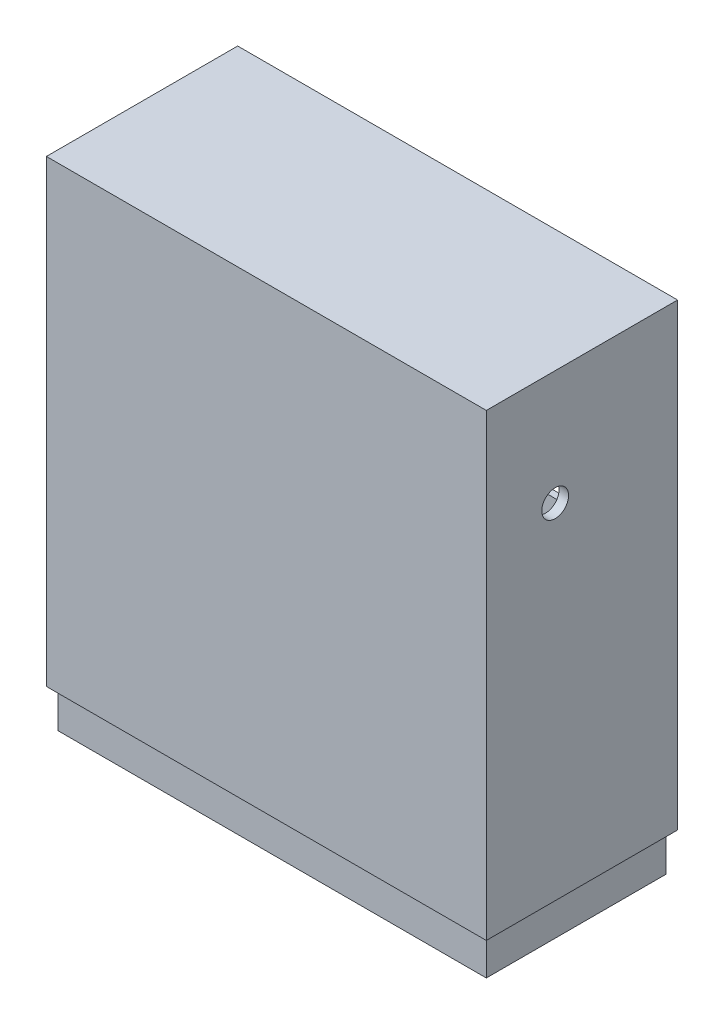
from build123d import *

# Parameters (mm, degrees)
SKETCH_1_W          = 115
SKETCH_1_H          = 50
EXTRUDE_1_DEPTH     = 120
SKETCH_4_W          = 86
SKETCH_4_H          = 44
CUT_EXTRUDE_3_DEPTH = 28
SKETCH_6_W          = 102
SKETCH_6_H          = 61
CUT_EXTRUDE_4_DEPTH = 1.8
SKETCH_8_W          = 112
SKETCH_8_H          = 47
EXTRUDE_3_DEPTH     = 10
SKETCH_10_W         = 110
SKETCH_10_H         = 44
CUT_EXTRUDE_5_DEPTH = 127
SKETCH_11_R         = 3.5
CUT_EXTRUDE_6_DEPTH = 10


with BuildPart() as part:
    # 草图1 → 凸台-拉伸1 (new body)
    with BuildSketch(Plane(origin=(0, 0, 0), x_dir=(1, 0, 0), z_dir=(0, 1, 0))):
        Rectangle(SKETCH_1_W, SKETCH_1_H)
    extrude(amount=EXTRUDE_1_DEPTH)

    # 草图4 → 切除-拉伸3 (cut)
    with BuildSketch(Plane(origin=(0, 0, -25), x_dir=(-1, 0, 0), z_dir=(0, 0, -1))):
        with Locations((0, 84.556060941)):
            Rectangle(SKETCH_4_W, SKETCH_4_H)
    extrude(amount=-CUT_EXTRUDE_3_DEPTH, mode=Mode.SUBTRACT)

    # 草图6 → 切除-拉伸4 (cut)
    with BuildSketch(Plane(origin=(0, 0, -25), x_dir=(-1, 0, 0), z_dir=(0, 0, -1))):
        with Locations((0, 84.556060941)):
            Rectangle(SKETCH_6_W, SKETCH_6_H)
    extrude(amount=-CUT_EXTRUDE_4_DEPTH, mode=Mode.SUBTRACT)

    # 草图8 → 凸台-拉伸3 (add)
    with BuildSketch(Plane.XZ):
        Rectangle(SKETCH_8_W, SKETCH_8_H)
    extrude(amount=EXTRUDE_3_DEPTH)

    # 草图10 → 切除-拉伸5 (cut)
    with BuildSketch(Plane.XZ.offset(10)):
        with Locations((0, 0.5)):
            Rectangle(SKETCH_10_W, SKETCH_10_H)
    extrude(amount=-CUT_EXTRUDE_5_DEPTH, mode=Mode.SUBTRACT)

    # 草图11 → 切除-拉伸6 (cut)
    with BuildSketch(Plane(origin=(57.5, 0, 0), x_dir=(0, 0, -1), z_dir=(1, 0, 0))):
        with Locations((-7, 90)):
            Circle(SKETCH_11_R)
    extrude(amount=-CUT_EXTRUDE_6_DEPTH, mode=Mode.SUBTRACT)


solid = part.part
